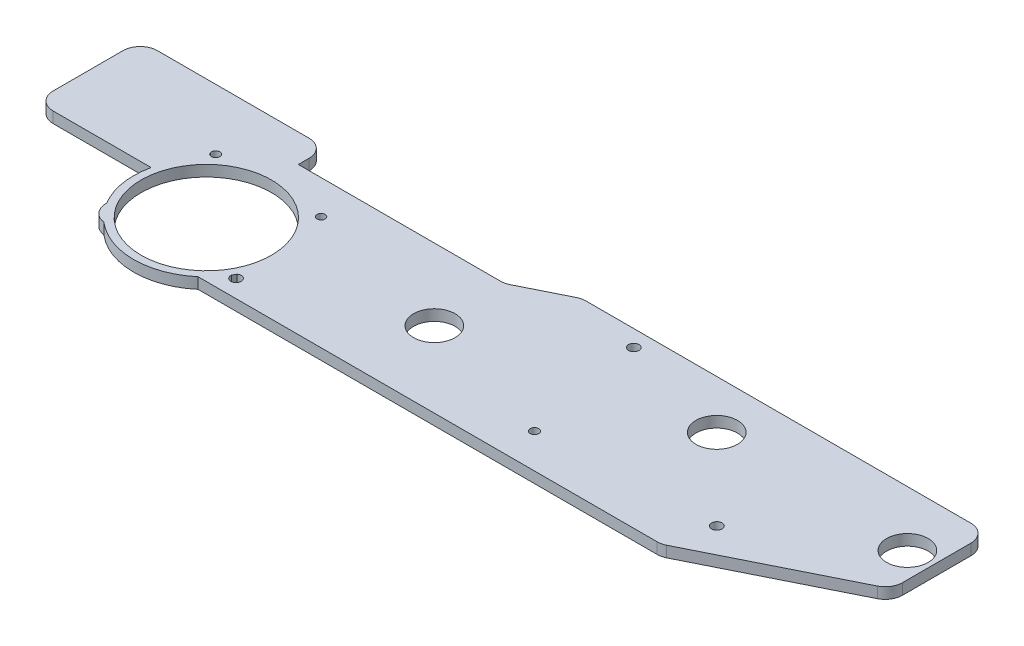
from build123d import *

# Parameters (mm, degrees)
SKETCH1_W           = 210
SKETCH1_H           = 50
SKETCH1_R           = 1.211665018
SKETCH1_R_2         = 1.165617118
SKETCH1_R_3         = 1.5
SKETCH1_R_4         = 1.25
SKETCH1_R_5         = 1.517273905
BOSS_EXTRUDE1_DEPTH = 3.175
SKETCH2_R           = 2
CUT_EXTRUDE1_DEPTH  = 10
SKETCH3_R           = 6
SKETCH3_R_2         = 0.586995366
CUT_EXTRUDE2_DEPTH  = 57.15
CUT_EXTRUDE7_DEPTH  = 10
FILLET3_R           = 5
SKETCH11_R          = 18.5
SKETCH11_R_2        = 2
BOSS_EXTRUDE4_DEPTH = 3.175
SKETCH12_R          = 21
BOSS_EXTRUDE5_DEPTH = 3.175
SKETCH13_R          = 18.85
CUT_EXTRUDE8_DEPTH  = 3.175
BOSS_EXTRUDE6_DEPTH = 3.175
FILLET4_R           = 5


with BuildPart() as part:
    # Sketch1 → Boss-Extrude1 (new body)
    with BuildSketch(Plane(origin=(0, 0, 0), x_dir=(1, 0, 0), z_dir=(0, 1, 0))):
        with Locations((105, -25)):
            Rectangle(SKETCH1_W, SKETCH1_H)
        with Locations(Location((3.489526233, -16.787661112, 0), (0, 0, 270))):
            Circle(SKETCH1_R, mode=Mode.SUBTRACT)
        with Locations(Location((34.37258772, -17.194005245, 0), (0, 0, 270))):
            Circle(SKETCH1_R_2, mode=Mode.SUBTRACT)
        with Locations(Location((37.520749958, -44.921198121, 0), (0, 0, 270))):
            Circle(SKETCH1_R_3, mode=Mode.SUBTRACT)
        with Locations(Location((118.879039361, -40.017685043, 0), (0, 0, 270))):
            Circle(SKETCH1_R_4, mode=Mode.SUBTRACT)
        with Locations(Location((112.302052499, -4.739260115, 0), (0, 0, 270))):
            Circle(SKETCH1_R_3, mode=Mode.SUBTRACT)
        with Locations(Location((168.975233936, -37.403209633, 0), (0, 0, 270))):
            Circle(SKETCH1_R_5, mode=Mode.SUBTRACT)
    extrude(amount=BOSS_EXTRUDE1_DEPTH)

    # Sketch2 → Cut-Extrude1 (cut)
    with BuildSketch(Plane(origin=(0, 3.175, 0), x_dir=(1, 0, 0), z_dir=(0, 1, 0))):
        with Locations(Location((10, -26, 0), (0, 0, 270))):
            Circle(SKETCH2_R)
        with Locations(Location((10, -42, 0), (0, 0, 270))):
            Circle(SKETCH2_R)
        with Locations(Location((26, -26, 0), (0, 0, 270))):
            Circle(SKETCH2_R)
        with Locations(Location((26, -42, 0), (0, 0, 270))):
            Circle(SKETCH2_R)
    extrude(amount=-CUT_EXTRUDE1_DEPTH, mode=Mode.SUBTRACT)

    # Sketch3 → Cut-Extrude2 (cut)
    with BuildSketch(Plane(origin=(0, 3.175, 0), x_dir=(1, 0, 0), z_dir=(0, 1, 0))):
        with Locations(Location((78.01026379, -28.1, 0), (0, 0, 270))):
            Circle(SKETCH3_R)
        with Locations(Location((145.531297368, -14, 0), (0, 0, 270))):
            Circle(SKETCH3_R)
        with Locations(Location((18, -34, 0), (0, 0, 270))):
            Circle(SKETCH3_R_2)
        with Locations(Location((202.646291021, -16, 0), (0, 0, 270))):
            Circle(SKETCH3_R)
    extrude(amount=-CUT_EXTRUDE2_DEPTH, mode=Mode.SUBTRACT)

    # Sketch10 → Cut-Extrude7 (cut)
    with BuildSketch(Plane(origin=(0, 3.175, 0), x_dir=(1, 0, 0), z_dir=(0, 1, 0))):
        Polygon((210, -27.859435908), (165.502877994, -50), (210, -50), align=None)
        Polygon((92.532613397, 0), (77.65477062, -7.402812063), (0, -7.402812063), (0, 0), align=None)
    extrude(amount=-CUT_EXTRUDE7_DEPTH, mode=Mode.SUBTRACT)

    # Fillet3
    fillet3_edges = [part.edges().sort_by_distance(p)[0] for p in [
        (210, 1.5875, 0),
        (0, 1.5875, 50),
        (92.532613397, 1.5875, 0),
        (210, 1.5875, 27.859435908),
        (165.502877994, 1.5875, 50),
        (77.65477062, 1.5875, 7.402812063),
        (0, 1.5875, 7.402812063),
    ]]
    fillet(fillet3_edges, radius=FILLET3_R)

    # Sketch11 → Boss-Extrude4 (add)
    with BuildSketch(Plane(origin=(0, 3.175, 0), x_dir=(1, 0, 0), z_dir=(0, 1, 0))):
        with Locations((18, -34)):
            Circle(SKETCH11_R)
        with Locations(Location((10, -26, 0), (0, 0, 270))):
            Circle(SKETCH11_R_2, mode=Mode.SUBTRACT)
        with Locations(Location((10, -42, 0), (0, 0, 270))):
            Circle(SKETCH11_R_2, mode=Mode.SUBTRACT)
        with Locations(Location((26, -26, 0), (0, 0, 270))):
            Circle(SKETCH11_R_2, mode=Mode.SUBTRACT)
        with Locations(Location((26, -42, 0), (0, 0, 270))):
            Circle(SKETCH11_R_2, mode=Mode.SUBTRACT)
    extrude(amount=-BOSS_EXTRUDE4_DEPTH)

    # Sketch12 → Boss-Extrude5 (add)
    with BuildSketch(Plane(origin=(0, 3.175, 0), x_dir=(1, 0, 0), z_dir=(0, 1, 0))):
        with Locations((18, -34)):
            Circle(SKETCH12_R)
    extrude(amount=-BOSS_EXTRUDE5_DEPTH)

    # Sketch13 → Cut-Extrude8 (cut)
    with BuildSketch(Plane(origin=(0, 3.175, 0), x_dir=(1, 0, 0), z_dir=(0, 1, 0))):
        with Locations(Location((18, -34, 0), (0, 0, 270))):
            Circle(SKETCH13_R)
    extrude(amount=-CUT_EXTRUDE8_DEPTH, mode=Mode.SUBTRACT)

    # Sketch14 → Boss-Extrude6 (add)
    with BuildSketch(Plane(origin=(0, 3.175, 0), x_dir=(1, 0, 0), z_dir=(0, 1, 0))):
        with BuildLine():
            Line((-35.83, -29.449062132), (-2.500950332, -29.449062132))
            ThreePointArc((-2.500950332, -29.449062132), (-1.503732803, -26.215116779), (0, -23.183346174))
            Line((0, -23.183346174), (0, -12.402812063))
            Line((0, -12.402812063), (0, -12.248529085))
            Line((0, -12.248529085), (0, 0.727187937))
            Line((0, 0.727187937), (-35.83, 0.727187937))
            Line((-35.83, 0.727187937), (-35.83, -29.449062132))
        make_face()
        with BuildLine():
            Line((0, 0.727187937), (0, -12.248529085))
            Line((0, -12.248529085), (0.002380891, -12.248529085))
            ThreePointArc((0.002380891, -12.248529085), (1.51944077, -8.813145304), (5, -7.402812063))
            Line((5, -7.402812063), (18, -7.402812063))
            Line((18, -7.402812063), (18, 0.727187937))
            Line((18, 0.727187937), (0, 0.727187937))
        make_face()
    extrude(amount=-BOSS_EXTRUDE6_DEPTH)

    # Fillet4
    fillet4_edges = [part.edges().sort_by_distance(p)[0] for p in [
        (-35.83, 1.5875, 29.449062132),
        (-35.83, 1.5875, -0.727187937),
        (18, 1.5875, -0.727187937),
    ]]
    fillet(fillet4_edges, radius=FILLET4_R)


solid = part.part
